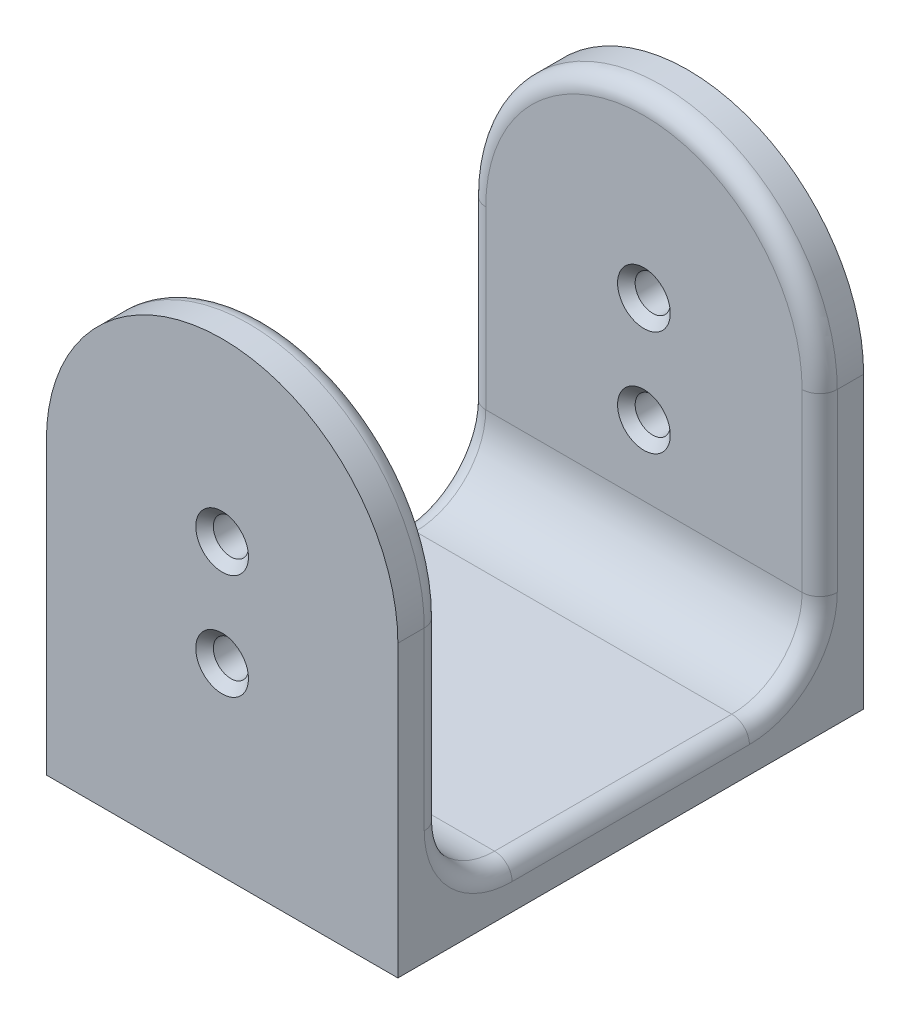
from build123d import *

# Parameters (mm, degrees)
SKETCH1_R           = 2
BOSS_EXTRUDE1_DEPTH = 2.5
BOSS_EXTRUDE2_START = -5
SKETCH2_W           = 40
SKETCH2_H           = 5
BOSS_EXTRUDE2_DEPTH = 53
SKETCH3_R           = 2
BOSS_EXTRUDE3_DEPTH = 5
FILLET2_R           = 8
FILLET1_R           = 2
CHAMFER1_SIZE       = 1


with BuildPart() as part:
    # Sketch1 → Boss-Extrude1 (new, symmetric)
    with BuildSketch(Plane.XY):
        with BuildLine():
            Line((-20, 0), (20, 0))
            Line((20, 0), (20, 33))
            ThreePointArc((20, 33), (0, 53), (-20, 33))
            Line((-20, 33), (-20, 0))
        make_face()
        with Locations((0, 33)):
            Circle(SKETCH1_R, mode=Mode.SUBTRACT)
        with Locations((0, 21)):
            Circle(SKETCH1_R, mode=Mode.SUBTRACT)
    extrude(amount=BOSS_EXTRUDE1_DEPTH, both=True)

    # Sketch2 → Boss-Extrude2 (add)
    with BuildSketch(Plane(origin=(0, 0, -2.5), x_dir=(-1, 0, 0), z_dir=(0, 0, -1)).offset(BOSS_EXTRUDE2_START)):
        with Locations((0, 2.5)):
            Rectangle(SKETCH2_W, SKETCH2_H)
    extrude(amount=BOSS_EXTRUDE2_DEPTH)

    # Sketch3 → Boss-Extrude3 (add)
    with BuildSketch(Plane(origin=(0, 0, -50.5), x_dir=(-1, 0, 0), z_dir=(0, 0, -1))):
        with BuildLine():
            Line((-20, 33), (-20, 5))
            Line((-20, 5), (20, 5))
            Line((20, 5), (20, 33))
            ThreePointArc((20, 33), (0, 53), (-20, 33))
        make_face()
        with Locations(Location((0, 21, 0), (0, 0, 180))):
            Circle(SKETCH3_R, mode=Mode.SUBTRACT)
        with Locations(Location((0, 33, 0), (0, 0, 180))):
            Circle(SKETCH3_R, mode=Mode.SUBTRACT)
    extrude(amount=-BOSS_EXTRUDE3_DEPTH)

    # Fillet2
    fillet2_edges = [part.edges().sort_by_distance(p)[0] for p in [
        (0, 5, -2.5),
        (0, 5, -45.5),
    ]]
    fillet(fillet2_edges, radius=FILLET2_R)

    # Fillet1
    fillet1_edges = [part.edges().sort_by_distance(p)[0] for p in [
        (0, 53, -45.5),
        (20, 23, -45.5),
        (-20, 23, -2.5),
        (-20, 5, -24),
        (20, 5, -24),
        (0, 53, -2.5),
        (-20, 23, -45.5),
        (20, 23, -2.5),
        (-20, 7.343145751, -43.156854249),
        (20, 7.343145751, -43.156854249),
        (-20, 7.343145751, -4.843145751),
        (20, 7.343145751, -4.843145751),
    ]]
    fillet(fillet1_edges, radius=FILLET1_R)

    # Chamfer1
    chamfer1_edges = [part.edges().sort_by_distance(p)[0] for p in [
        (-2, 33, -2.5),
        (-2, 33, 2.5),
        (-2, 21, -2.5),
        (-2, 21, 2.5),
        (-2, 33, -45.5),
        (-2, 21, -45.5),
        (-2, 21, -50.5),
        (-2, 33, -50.5),
    ]]
    chamfer(chamfer1_edges, length=CHAMFER1_SIZE)


solid = part.part
